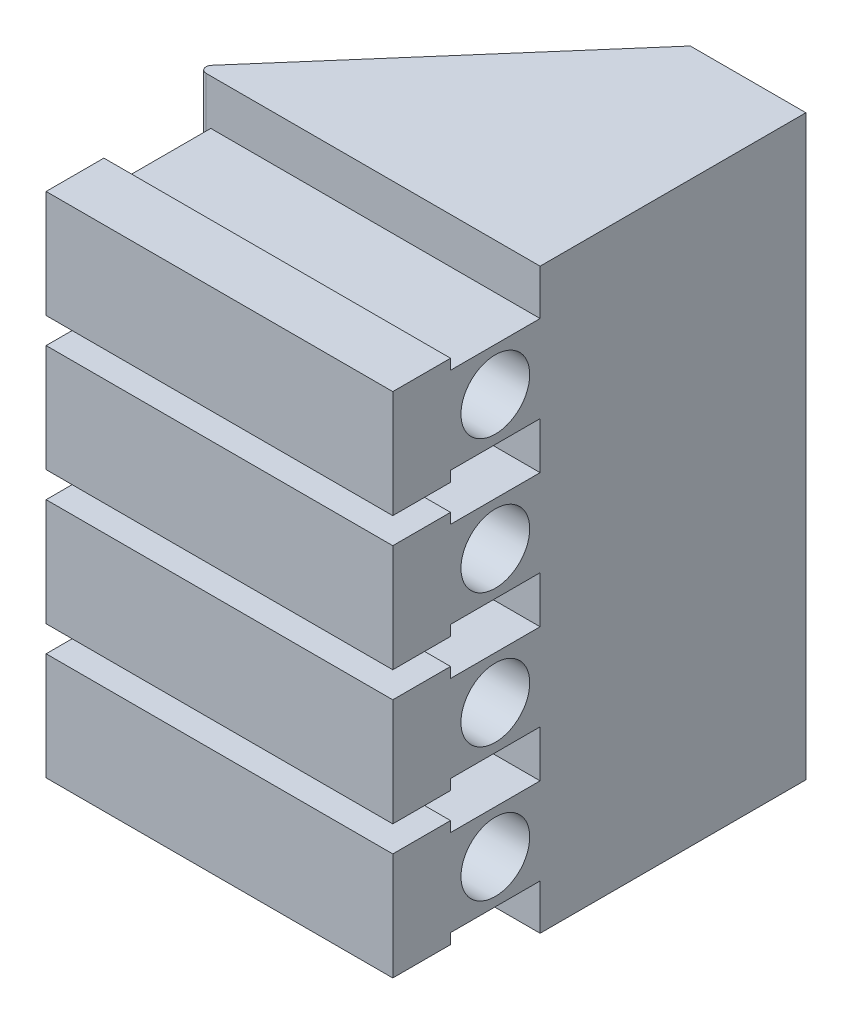
from build123d import *

# Parameters (mm, degrees)
SKETCH1_W           = 20
SKETCH1_H           = 46.001723395
BOSS_EXTRUDE1_DEPTH = 100
SKETCH8_W           = 15.5
SKETCH8_H           = 15
BOSS_EXTRUDE2_DEPTH = 57
SKETCH10_R          = 5.95
CUT_EXTRUDE1_DEPTH  = 51
SKETCH11_W          = 10
SKETCH11_H          = 18.6
BOSS_EXTRUDE3_DEPTH = 60
FILLET2_R           = 1


with BuildPart() as part:
    # Sketch1 → Boss-Extrude1 (new body)
    with BuildSketch(Plane(origin=(0, 0, 0), x_dir=(1, 0, 0), z_dir=(0, 1, 0))):
        Polygon((-17.351649908, 20.312727502), (-57.351649908, -25.688995893), (-17.351649908, -25.688995893), align=None)
        with Locations((-7.351649908, -2.688134195)):
            Rectangle(SKETCH1_W, SKETCH1_H)
    extrude(amount=-BOSS_EXTRUDE1_DEPTH)

    # Sketch8 → Boss-Extrude2 (add)
    with BuildSketch(Plane(origin=(2.648350092, 0, 0), x_dir=(0, 0, -1), z_dir=(1, 0, 0))):
        with Locations((-33.438995893, -15.35)):
            Rectangle(SKETCH8_W, SKETCH8_H)
        with Locations((-33.438995893, -38.45)):
            Rectangle(SKETCH8_W, SKETCH8_H)
        with Locations((-33.438995893, -61.55)):
            Rectangle(SKETCH8_W, SKETCH8_H)
        with Locations((-33.438995893, -84.65)):
            Rectangle(SKETCH8_W, SKETCH8_H)
    extrude(amount=-BOSS_EXTRUDE2_DEPTH)

    # Sketch10 → Cut-Extrude1 (cut)
    with BuildSketch(Plane(origin=(2.648350092, 0, 0), x_dir=(0, 0, -1), z_dir=(1, 0, 0))):
        with Locations((-33.438995893, -15.35)):
            Circle(SKETCH10_R)
        with Locations((-33.438995893, -38.45)):
            Circle(SKETCH10_R)
        with Locations((-33.438995893, -61.55)):
            Circle(SKETCH10_R)
        with Locations((-33.438995893, -84.65)):
            Circle(SKETCH10_R)
    extrude(amount=-CUT_EXTRUDE1_DEPTH, mode=Mode.SUBTRACT)

    # Sketch11 → Boss-Extrude3 (add)
    with BuildSketch(Plane(origin=(2.648350092, 0, 0), x_dir=(0, 0, -1), z_dir=(1, 0, 0))):
        with Locations((-46.188995893, -15.35)):
            Rectangle(SKETCH11_W, SKETCH11_H)
        with Locations((-46.188995893, -38.45)):
            Rectangle(SKETCH11_W, SKETCH11_H)
        with Locations((-46.188995893, -84.65)):
            Rectangle(SKETCH11_W, SKETCH11_H)
        with Locations((-46.188995893, -61.55)):
            Rectangle(SKETCH11_W, SKETCH11_H)
    extrude(amount=-BOSS_EXTRUDE3_DEPTH)

    # Fillet2
    fillet2_edges = [part.edges().sort_by_distance(p)[0] for p in [
        (-57.351649908, -50, 25.688995893),
    ]]
    fillet(fillet2_edges, radius=FILLET2_R)


solid = part.part
